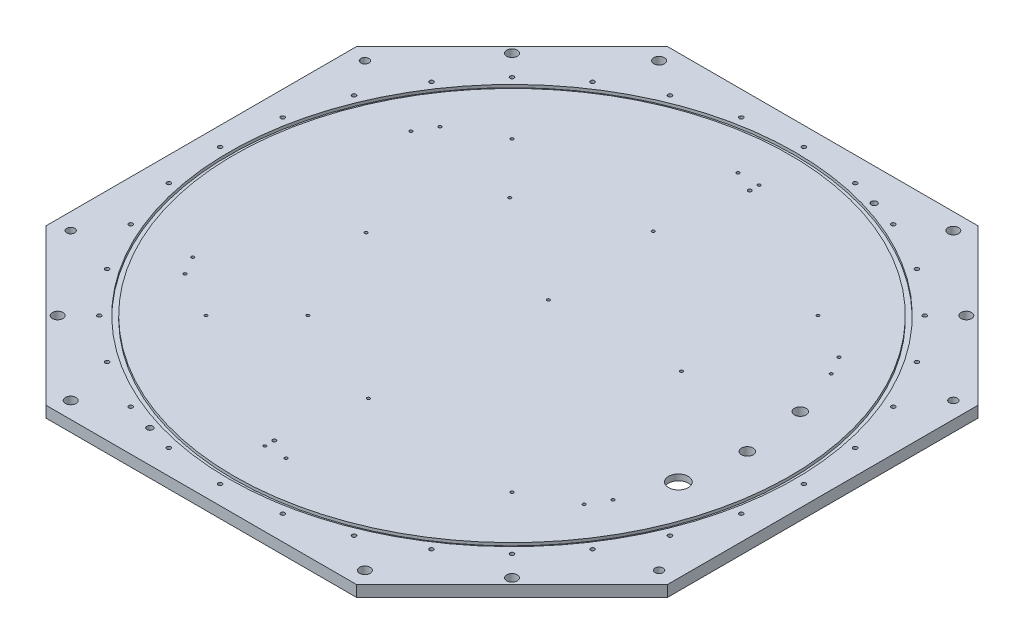
from build123d import *

# Parameters (mm, degrees)
BASE_PLATE_PROFILE_DEPTH                     = 4.7625
M3_CLEARANCE_HOLE_FOR_CYLINDER_D             = 3.4
M3X0_5_TAPPED_HOLE_FOR_SUPPORT_PILLARS_D     = 2.5
M3X0_5_TAPPED_HOLE_FOR_SUPPORT_PILLARS_DEPTH = 7.5
M3X0_5_TAPPED_HOLE_FOR_SUPPORT_PILLARS_TIP   = 0.751075774
F_3_0MM_DOWEL_HOLE_FOR_SUPPORT_PILLARS_D     = 3
F_3_0MM_DOWEL_HOLE_FOR_SUPPORT_PILLARS_DEPTH = 6
F_3_0MM_DOWEL_HOLE_FOR_SUPPORT_PILLARS_TIP   = 0.901290929
M3X0_5_TAPPED_HOLE_FOR_PCB_STANDOFFS_D       = 2.5
M3X0_5_TAPPED_HOLE_FOR_PCB_STANDOFFS_DEPTH   = 6.5
M3X0_5_TAPPED_HOLE_FOR_PCB_STANDOFFS_TIP     = 0.751075774
M8_CLEARANCE_HOLE_FOR_LIFTING_ALIGNM_D       = 9
M8X1_25_TAPPED_HOLE_FOR_SUPER_STRUCTURE_D    = 6.8
F_7_16_20_TAPPED_HOLE_FOR_PENETRATOR_D       = 9.92124
SKETCH28_R                                   = 240.5
SKETCH28_R_2                                 = 236.3344
O_RING_GROOVE_DEPTH                          = 2.413
CIRPATTERN_EXTRACABLES_COUNT                 = 2
CIRPATTERN_EXTRACABLES_ANGLE                 = 15
F_5_8_CLEARANCE_HOLE1_D                      = 16.66748
SKETCH35_R                                   = 18
CUT_EXTRUDE1_DEPTH                           = 4.5
M8_CLEARANCE_HOLE_D                          = 9
F_5_0MM_DOWEL_HOLE1_D                        = 5.05
F_5_0MM_DOWEL_HOLE1_DEPTH                    = 5
F_5_0MM_DOWEL_HOLE1_TIP                      = 1.517173063


with BuildPart() as part:
    # Sketch1 → Base Plate Profile (new, symmetric)
    with BuildSketch(Plane(origin=(0, 0, 0), x_dir=(1, 0, 0), z_dir=(0, 1, 0))):
        Polygon((-131.979797464, 264), (131.979797464, 264), (264, 131.979797464), (264, -131.979797464), (131.979797464, -264), (-131.979797464, -264), (-264, -131.979797464), (-264, 131.979797464), align=None)
    extrude(amount=BASE_PLATE_PROFILE_DEPTH, both=True)

    # M3 Clearance Hole - For Cylinder (through all)
    with Locations(Plane(origin=(0, 4.7625, 0), x_dir=(1, 0, 0), z_dir=(0, 1, 0))):
        with Locations((248, 0), (243.23474954, -48.38239986), (229.122124063, -94.905491227), (206.204463851, -137.781417789), (175.362481734, -175.362481734), (137.781417789, -206.204463851), (94.905491227, -229.122124063), (48.38239986, -243.23474954), (0, -248), (-48.38239986, -243.23474954), (-94.905491227, -229.122124063), (-137.781417789, -206.204463851), (-175.362481734, -175.362481734), (-206.204463851, -137.781417789), (-229.122124063, -94.905491227), (-243.23474954, -48.38239986), (-248, 0), (-243.23474954, 48.38239986), (-229.122124063, 94.905491227), (-206.204463851, 137.781417789), (-175.362481734, 175.362481734), (-137.781417789, 206.204463851), (-94.905491227, 229.122124063), (-48.38239986, 243.23474954), (0, 248), (48.38239986, 243.23474954), (94.905491227, 229.122124063), (137.781417789, 206.204463851), (175.362481734, 175.362481734), (206.204463851, 137.781417789), (229.122124063, 94.905491227), (243.23474954, 48.38239986)):
            Hole(M3_CLEARANCE_HOLE_FOR_CYLINDER_D / 2)

    # M3x0.5 Tapped Hole - For Support Pillars
    with Locations(Plane(origin=(0, 4.7625, 0), x_dir=(1, 0, 0), z_dir=(0, 1, 0))):
        with Locations((-9, 201), (9, 201), (169.571106161, 108.294228634), (178.571106161, 92.705771366), (178.571106161, -92.705771366), (169.571106161, -108.294228634), (9, -201), (-9, -201), (-169.571106161, -108.294228634), (-178.571106161, -92.705771366), (-178.571106161, 92.705771366), (-169.571106161, 108.294228634)):
            Hole(M3X0_5_TAPPED_HOLE_FOR_SUPPORT_PILLARS_D / 2, depth=M3X0_5_TAPPED_HOLE_FOR_SUPPORT_PILLARS_DEPTH)
            with Locations((0, 0, -(M3X0_5_TAPPED_HOLE_FOR_SUPPORT_PILLARS_DEPTH + M3X0_5_TAPPED_HOLE_FOR_SUPPORT_PILLARS_TIP / 2))):  # 118° drill point
                Cone(0, M3X0_5_TAPPED_HOLE_FOR_SUPPORT_PILLARS_D / 2, M3X0_5_TAPPED_HOLE_FOR_SUPPORT_PILLARS_TIP, mode=Mode.SUBTRACT)

    # Ø3.0mm Dowel Hole - For Support Pillars
    with Locations(Plane(origin=(0, 4.7625, 0), x_dir=(1, 0, 0), z_dir=(0, 1, 0))):
        with Locations((9, 193), (-9, -193)):
            Hole(F_3_0MM_DOWEL_HOLE_FOR_SUPPORT_PILLARS_D / 2, depth=F_3_0MM_DOWEL_HOLE_FOR_SUPPORT_PILLARS_DEPTH)
            with Locations((0, 0, -(F_3_0MM_DOWEL_HOLE_FOR_SUPPORT_PILLARS_DEPTH + F_3_0MM_DOWEL_HOLE_FOR_SUPPORT_PILLARS_TIP / 2))):  # 118° drill point
                Cone(0, F_3_0MM_DOWEL_HOLE_FOR_SUPPORT_PILLARS_D / 2, F_3_0MM_DOWEL_HOLE_FOR_SUPPORT_PILLARS_TIP, mode=Mode.SUBTRACT)

    # M3x0.5 Tapped Hole - For PCB Standoffs
    with Locations(Plane(origin=(0, 4.7625, 0), x_dir=(1, 0, 0), z_dir=(0, 1, 0))):
        with Locations((113, 31), (-130, -130), (130, -130), (130, 130), (-130, 130), (-86.8, -86.7), (0, -122), (-123, -1), (-87.7, 85.8), (4, 27), (-2, 122)):
            Hole(M3X0_5_TAPPED_HOLE_FOR_PCB_STANDOFFS_D / 2, depth=M3X0_5_TAPPED_HOLE_FOR_PCB_STANDOFFS_DEPTH)
            with Locations((0, 0, -(M3X0_5_TAPPED_HOLE_FOR_PCB_STANDOFFS_DEPTH + M3X0_5_TAPPED_HOLE_FOR_PCB_STANDOFFS_TIP / 2))):  # 118° drill point
                Cone(0, M3X0_5_TAPPED_HOLE_FOR_PCB_STANDOFFS_D / 2, M3X0_5_TAPPED_HOLE_FOR_PCB_STANDOFFS_TIP, mode=Mode.SUBTRACT)

    # M8 Clearance Hole - For Lifting / Alignment (through all)
    with Locations(Plane(origin=(0, 4.7625, 0), x_dir=(1, 0, 0), z_dir=(0, 1, 0))):
        with Locations((-193.040151264, -193.040151264), (-193.040151264, 193.040151264), (193.040151264, 193.040151264), (193.040151264, -193.040151264)):
            Hole(M8_CLEARANCE_HOLE_FOR_LIFTING_ALIGNM_D / 2)

    # M8x1.25 Tapped Hole -For Super Structure (through all)
    with Locations(Plane(origin=(0, 4.7625, 0), x_dir=(1, 0, 0), z_dir=(0, 1, 0))):
        with Locations((250, 125), (-250, -125), (-250, 125), (250, -125)):
            Hole(M8X1_25_TAPPED_HOLE_FOR_SUPER_STRUCTURE_D / 2)

    # 7/16-20 Tapped Hole - For Penetrator (through all)
    with Locations(Plane(origin=(0, -4.7625, 0), x_dir=(-1, 0, 0), z_dir=(0, -1, 0))):
        with Locations((-200, 0)):
            f_7_16_20_tapped_hole_for_penetrator = Hole(F_7_16_20_TAPPED_HOLE_FOR_PENETRATOR_D / 2)

    # Sketch28 → O-ring Groove (cut)
    with BuildSketch(Plane(origin=(0, 4.7625, 0), x_dir=(1, 0, 0), z_dir=(0, 1, 0))):
        with Locations(Location((0, 0, 0), (0, 0, 270))):
            Circle(SKETCH28_R)
        with Locations(Location((0, 0, 0), (0, 0, 270))):
            Circle(SKETCH28_R_2, mode=Mode.SUBTRACT)
    extrude(amount=-O_RING_GROOVE_DEPTH, mode=Mode.SUBTRACT)

    # CirPattern_extraCables: 7/16-20 Tapped Hole - For Penetrator ×2 about axis
    cirpattern_extracables_axis = Axis((0, -5.23875, 0), (0, 1, 0))
    for i in range(1, CIRPATTERN_EXTRACABLES_COUNT):
        add(f_7_16_20_tapped_hole_for_penetrator.rotate(cirpattern_extracables_axis, i * CIRPATTERN_EXTRACABLES_ANGLE / (CIRPATTERN_EXTRACABLES_COUNT - 1)), mode=Mode.SUBTRACT)

    # 5/8 Clearance Hole1 (through all)
    with Locations(Plane(origin=(0, 4.7625, 0), x_dir=(1, 0, 0), z_dir=(0, 1, 0))):
        with Locations((193.185165258, -51.763809021)):
            Hole(F_5_8_CLEARANCE_HOLE1_D / 2)

    # Sketch35 → Cut-Extrude1 (cut)
    with BuildSketch(Plane.XZ.offset(4.7625)):
        with Locations(Location((193.185165258, 51.763809021, 0), (0, 0, 270))):
            Circle(SKETCH35_R)
    extrude(amount=-CUT_EXTRUDE1_DEPTH, mode=Mode.SUBTRACT)

    # M8 Clearance Hole (through all)
    with Locations(Plane(origin=(-28.123925909, 4.7625, -48.06749493), x_dir=(1, 0, 0), z_dir=(0, 1, 0))):
        with Locations((-96.876074091, -298.06749493), (-96.876074091, 201.93250507), (153.123925909, -298.06749493), (153.123925909, 201.93250507)):
            Hole(M8_CLEARANCE_HOLE_D / 2)

    # Ø5.0mm Dowel Hole1
    with Locations(Plane(origin=(0, 4.7625, 0), x_dir=(1, 0, 0), z_dir=(0, 1, 0))):
        with Locations((71.184478229, 236.520126119), (-71.184478229, -236.520126119)):
            Hole(F_5_0MM_DOWEL_HOLE1_D / 2, depth=F_5_0MM_DOWEL_HOLE1_DEPTH)
            with Locations((0, 0, -(F_5_0MM_DOWEL_HOLE1_DEPTH + F_5_0MM_DOWEL_HOLE1_TIP / 2))):  # 118° drill point
                Cone(0, F_5_0MM_DOWEL_HOLE1_D / 2, F_5_0MM_DOWEL_HOLE1_TIP, mode=Mode.SUBTRACT)


solid = part.part
